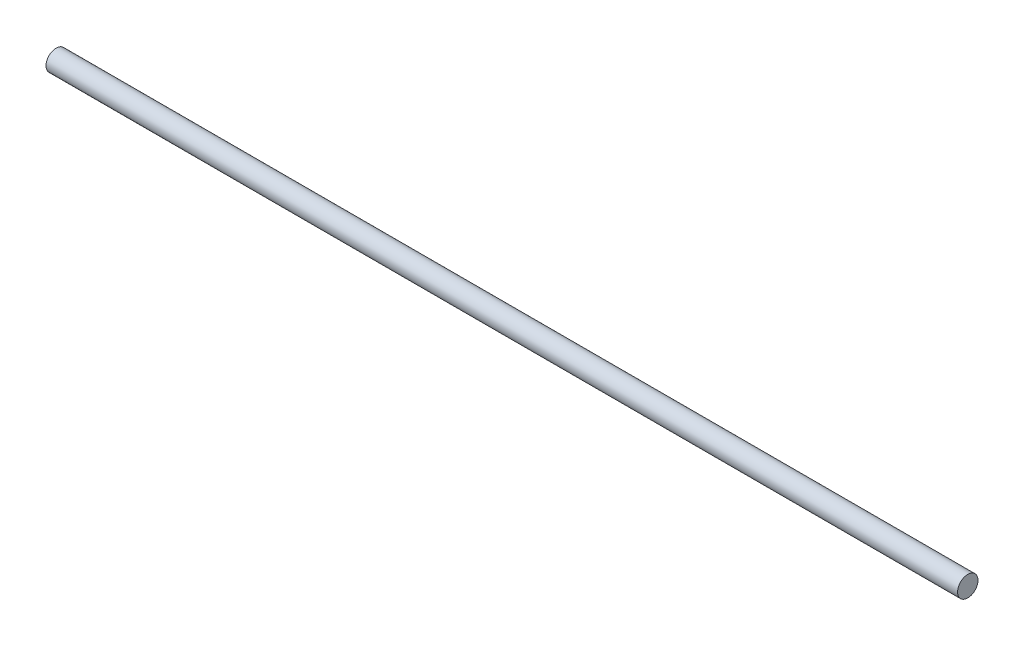
from build123d import *

# Parameters (mm, degrees)
SKETCH1_R           = 4
BOSS_EXTRUDE1_DEPTH = 178.5


with BuildPart() as part:
    # Sketch1 → Boss-Extrude1 (new, symmetric)
    with BuildSketch(Plane(origin=(0, 0, 0), x_dir=(0, 0, -1), z_dir=(1, 0, 0))):
        Circle(SKETCH1_R)
    extrude(amount=BOSS_EXTRUDE1_DEPTH, both=True)


solid = part.part
